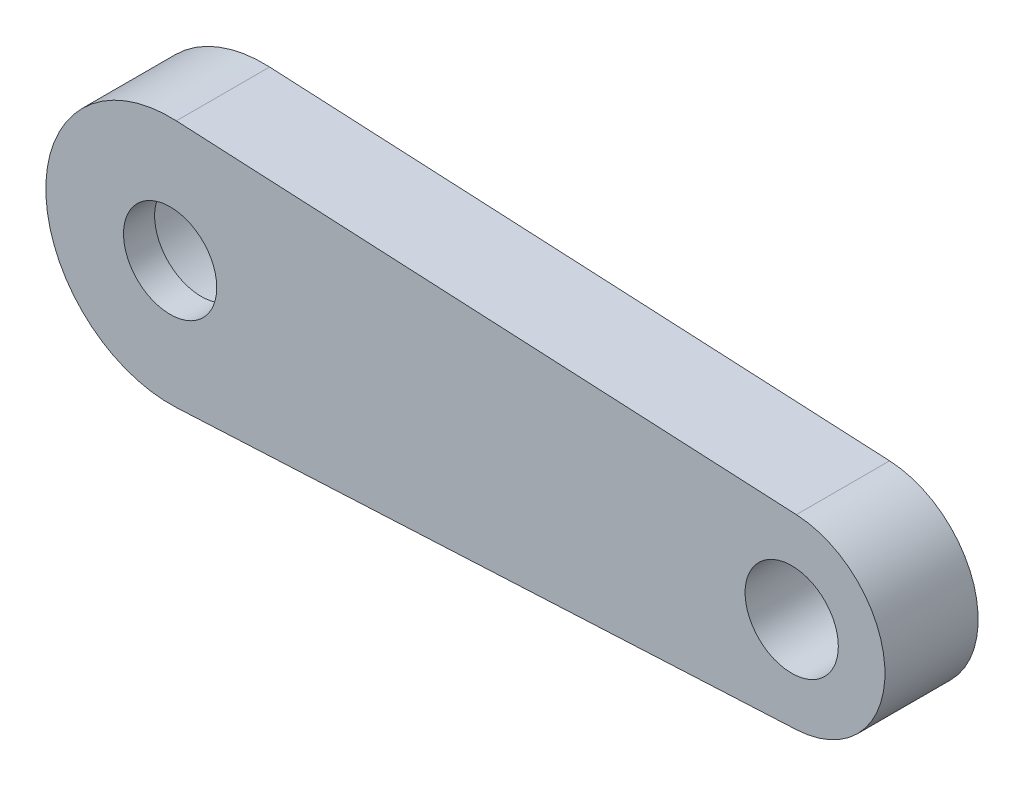
from build123d import *

# Parameters (mm, degrees)
ESQUISSE1_R             = 1.5
BOSS_EXTRU_1_DEPTH      = 3
ESQUISSE1_4_R           = 2.5
ESQUISSE1_4_R_2         = 1.5
ENL_V_MAT_EXTRU_1_DEPTH = 2


with BuildPart() as part:
    # Esquisse1 → Boss.-Extru.1 (new body)
    with BuildSketch(Plane.XY):
        with BuildLine():
            Line((20.15, 2.996247653), (0.2, 3.994996871))
            ThreePointArc((0.2, 3.994996871), (-4, 0), (0.2, -3.994996871))
            Line((0.2, -3.994996871), (20.15, -2.996247653))
            ThreePointArc((20.15, -2.996247653), (23, 0), (20.15, 2.996247653))
        make_face()
        with Locations((20, 0)):
            Circle(ESQUISSE1_R, mode=Mode.SUBTRACT)
        Circle(ESQUISSE1_R, mode=Mode.SUBTRACT)
    extrude(amount=BOSS_EXTRU_1_DEPTH)

    # Esquisse1<4> → Enlèv. mat.-Extru.1 (cut)
    with BuildSketch(Plane.XY):
        Circle(ESQUISSE1_4_R)
        Circle(ESQUISSE1_4_R_2, mode=Mode.SUBTRACT)
    extrude(amount=ENL_V_MAT_EXTRU_1_DEPTH, mode=Mode.SUBTRACT)


solid = part.part
